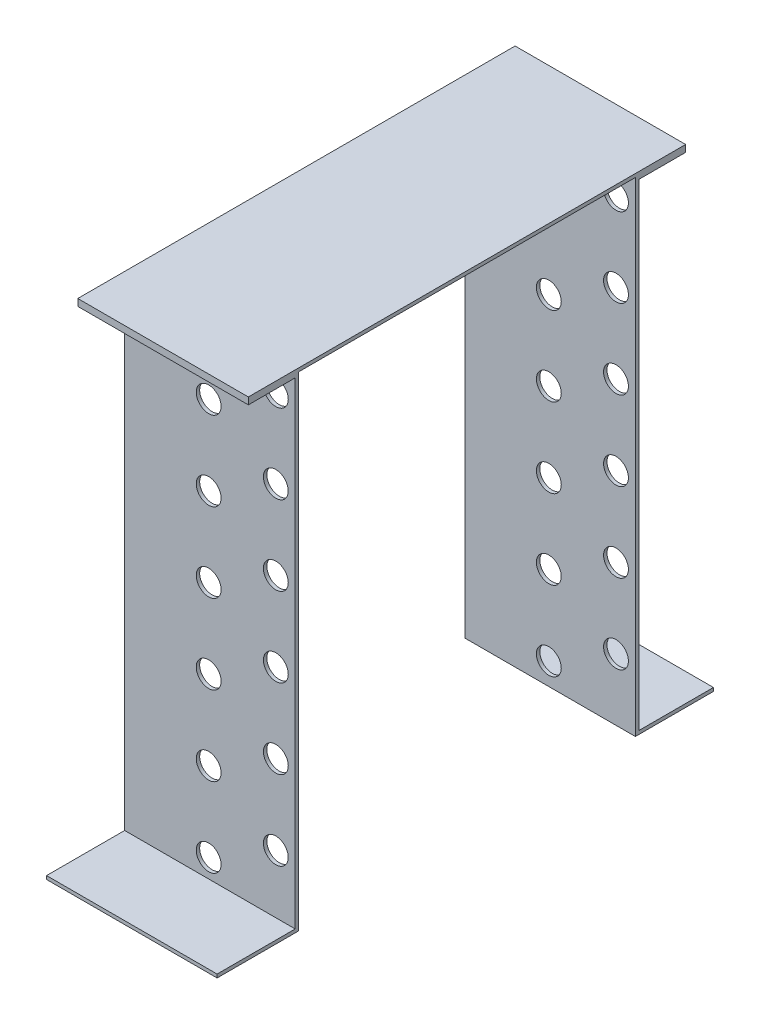
from build123d import *

# Parameters (mm, degrees)
RESSALTO_EXTRUS_O1_DEPTH = 54.6
ESBO_O2_R                = 3.98
CORTE_EXTRUS_O1_DEPTH    = 212.979645249


with BuildPart() as part:
    # Esboço1 → Ressalto-extrusão1 (new body)
    with BuildSketch(Plane(origin=(0, 0, 0), x_dir=(0, 0, -1), z_dir=(1, 0, 0))):
        Polygon((0, 0), (25, 0), (25, 152.8), (10, 152.8), (10, 153.9), (10, 155), (26.1, 155), (133.9, 155), (150, 155), (150, 152.8), (135, 152.8), (135, 0), (158.9, 0), (158.9, -1.1), (133.9, -1.1), (133.9, 153.9), (26.1, 153.9), (26.1, -1.1), (0, -1.1), align=None)
    extrude(amount=RESSALTO_EXTRUS_O1_DEPTH)

    # Esboço2 → Corte-extrusão1 (cut, through all)
    with BuildSketch(Plane.XY.offset(-25)):
        with Locations((26.9, 6)):
            Circle(ESBO_O2_R)
        with Locations((48.4, 18.7)):
            Circle(ESBO_O2_R)
        with Locations((26.9, 31.4)):
            Circle(ESBO_O2_R)
        with Locations((48.4, 44.1)):
            Circle(ESBO_O2_R)
        with Locations((26.9, 56.8)):
            Circle(ESBO_O2_R)
        with Locations((48.4, 69.5)):
            Circle(ESBO_O2_R)
        with Locations((26.9, 82.2)):
            Circle(ESBO_O2_R)
        with Locations((48.4, 94.9)):
            Circle(ESBO_O2_R)
        with Locations((26.9, 107.6)):
            Circle(ESBO_O2_R)
        with Locations((48.4, 120.3)):
            Circle(ESBO_O2_R)
        with Locations((26.9, 133)):
            Circle(ESBO_O2_R)
        with Locations((48.4, 145.7)):
            Circle(ESBO_O2_R)
    extrude(amount=-CORTE_EXTRUS_O1_DEPTH, mode=Mode.SUBTRACT)


solid = part.part
